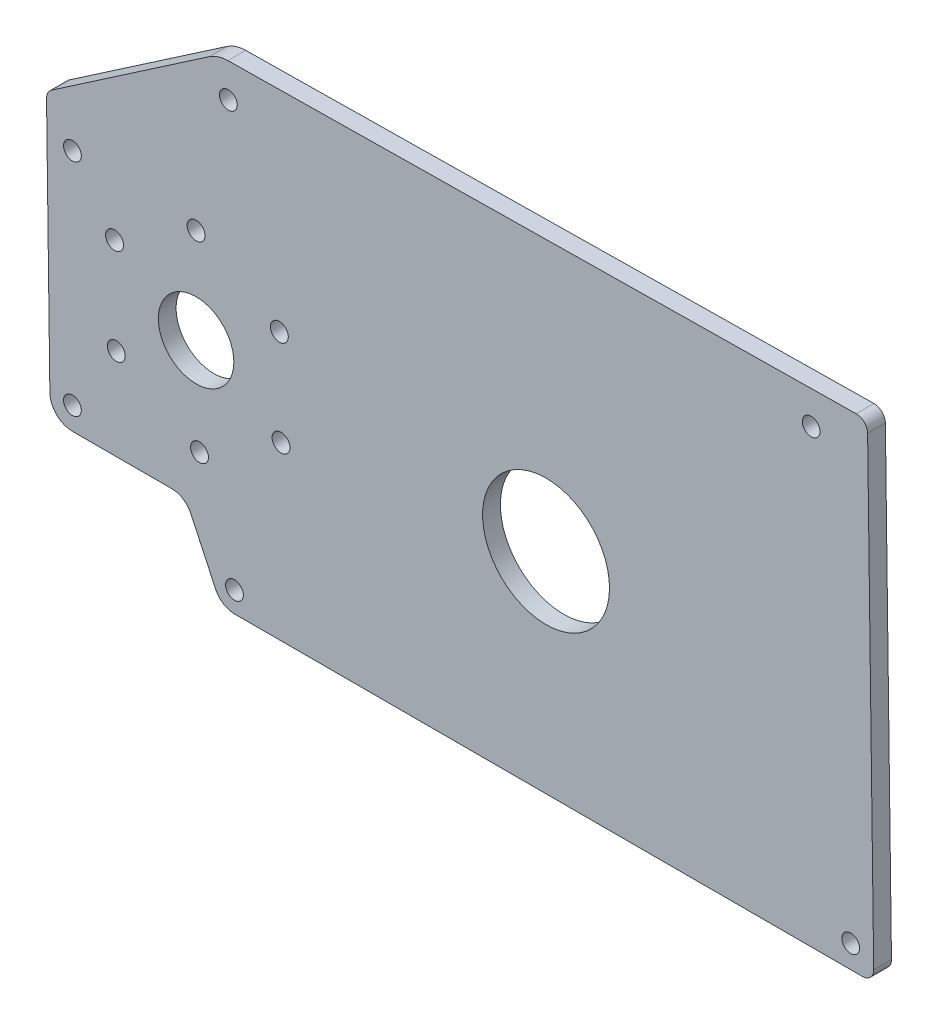
from build123d import *

# Parameters (mm, degrees)
SKETCH1_R           = 2
SKETCH1_R_2         = 14.29
SKETCH1_R_3         = 2.0193
SKETCH1_R_4         = 8.5
BOSS_EXTRUDE1_DEPTH = 4


with BuildPart() as part:
    # Sketch1 → Boss-Extrude1 (new body)
    with BuildSketch(Plane.XY):
        with BuildLine():
            Line((17.566132686, -48.57422294), (-4.85811184, -48.57422294))
            ThreePointArc((-4.85811184, -48.57422294), (-8.450214288, -47.086325388), (-9.93811184, -43.49422294))
            Line((-9.93811184, -43.49422294), (-10.688835244, 13.472862597))
            ThreePointArc((-10.688835244, 13.472862597), (-10.403338368, 14.676721118), (-9.582963432, 15.602879187))
            Line((-9.582963432, 15.602879187), (-6.619834827, 17.62947485))
            Line((-6.619834827, 17.62947485), (16.768305704, 33.625508255))
            Line((16.768305704, 33.625508255), (25.964523002, 39.915148892))
            ThreePointArc((25.964523002, 39.915148892), (27.966960045, 40.890333383), (30.165836856, 41.244846678))
            Line((30.165836856, 41.244846678), (171.657580351, 43.10945257))
            ThreePointArc((171.657580351, 43.10945257), (173.463278691, 42.389235045), (174.230829536, 40.603142807))
            Line((174.230829536, 40.603142807), (175.600950315, -63.36562536))
            ThreePointArc((175.600950315, -63.36562536), (174.869016667, -65.183273725), (173.061170841, -65.939095071))
            Line((173.061170841, -65.939095071), (66.523565599, -65.939095071))
            Line((66.523565599, -65.939095071), (31.633252021, -65.939095071))
            ThreePointArc((31.633252021, -65.939095071), (29.123552435, -65.208231246), (27.398652648, -63.244185761))
            Line((27.398652648, -63.244185761), (21.800732059, -51.26913225))
            ThreePointArc((21.800732059, -51.26913225), (20.075832272, -49.305086766), (17.566132686, -48.57422294))
        make_face()
        with Locations((-4.85811184, -43.49422294)):
            Circle(SKETCH1_R, mode=Mode.SUBTRACT)
        with Locations((101.811349412, -18.649052962)):
            Circle(SKETCH1_R_2, mode=Mode.SUBTRACT)
        with Locations((31.633252021, -61.264657987)):
            Circle(SKETCH1_R, mode=Mode.SUBTRACT)
        with Locations((30.266245989, 33.625508255)):
            Circle(SKETCH1_R, mode=Mode.SUBTRACT)
        with Locations((170.426367515, -60.775756941)):
            Circle(SKETCH1_R, mode=Mode.SUBTRACT)
        with Locations((161.513898191, 35.55251649)):
            Circle(SKETCH1_R, mode=Mode.SUBTRACT)
        with Locations((-4.85811184, 6.145317428)):
            Circle(SKETCH1_R, mode=Mode.SUBTRACT)
        with Locations((5.016318477, -27.95525743)):
            Circle(SKETCH1_R_3, mode=Mode.SUBTRACT)
        with Locations((4.630040098, -6.53094231)):
            Circle(SKETCH1_R_3, mode=Mode.SUBTRACT)
        with Locations((22.99090206, 4.515742139)):
            Circle(SKETCH1_R_3, mode=Mode.SUBTRACT)
        with Locations((41.738042402, -5.861888531)):
            Circle(SKETCH1_R_3, mode=Mode.SUBTRACT)
        with Locations((42.124320782, -27.286203651)):
            Circle(SKETCH1_R_3, mode=Mode.SUBTRACT)
        with Locations((23.763458819, -38.3328881)):
            Circle(SKETCH1_R_3, mode=Mode.SUBTRACT)
        with Locations((22.99090206, -16.893296926)):
            Circle(SKETCH1_R_4, mode=Mode.SUBTRACT)
    extrude(amount=BOSS_EXTRUDE1_DEPTH)


solid = part.part
